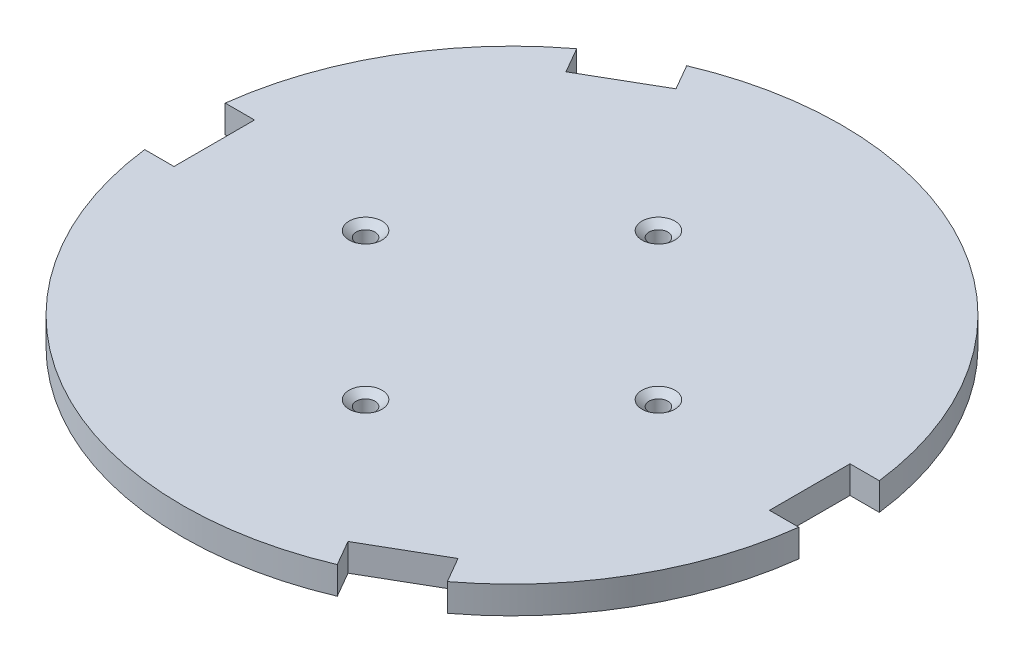
from build123d import *

# Parameters (mm, degrees)
SKETCH1_R                                         = 57.15
BOSS_EXTRUDE1_DEPTH                               = 4.7625
CUT_EXTRUDE2_REACH                                = 82.963
CUT_EXTRUDE3_REACH                                = 82.661
CSK_FOR_4_FLAT_HEAD_MACHINE_SCREW_100_D           = 3.2639
CSK_FOR_4_FLAT_HEAD_MACHINE_SCREW_100_CSINK_D     = 5.715
CSK_FOR_4_FLAT_HEAD_MACHINE_SCREW_100_CSINK_ANGLE = 100


with BuildPart() as part:
    # Sketch1 → Boss-Extrude1 (new body)
    with BuildSketch(Plane(origin=(0, 0, 0), x_dir=(1, 0, 0), z_dir=(0, 1, 0))):
        with Locations(Location((0, 0, 0), (0, 0, 90))):
            Circle(SKETCH1_R)
    extrude(amount=BOSS_EXTRUDE1_DEPTH)

    # Sketch2 → Cut-Extrude2 (cut, up to next)
    with BuildSketch(Plane(origin=(0, 4.7625, 0), x_dir=(1, 0, 0), z_dir=(0, 1, 0)), mode=Mode.PRIVATE) as cut_extrude2_sk1:
        with BuildLine():
            Line((51.641532728, 6.985), (51.641532728, -6.985))
            Line((51.641532728, -6.985), (56.721532728, -6.985))
            ThreePointArc((56.721532728, -6.985), (57.15, 0), (56.721532728, 6.985))
            Line((56.721532728, 6.985), (51.641532728, 6.985))
        make_face()
    cut_extrude2_tool1 = extrude(cut_extrude2_sk1.sketch, amount=-CUT_EXTRUDE2_REACH, mode=Mode.PRIVATE) & part.part
    # Sketch2 → Cut-Extrude2 (cut, up to next)
    with BuildSketch(Plane(origin=(0, 4.7625, 0), x_dir=(1, 0, 0), z_dir=(0, 1, 0)), mode=Mode.PRIVATE) as cut_extrude2_sk2:
        with BuildLine():
            Line((-51.641532728, 6.985), (-56.721532728, 6.985))
            ThreePointArc((-56.721532728, 6.985), (-57.15, 0), (-56.721532728, -6.985))
            Line((-56.721532728, -6.985), (-51.641532728, -6.985))
            Line((-51.641532728, -6.985), (-51.641532728, 6.985))
        make_face()
    cut_extrude2_tool2 = extrude(cut_extrude2_sk2.sketch, amount=-CUT_EXTRUDE2_REACH, mode=Mode.PRIVATE) & part.part
    add(cut_extrude2_tool1.solids().sort_by_distance((54.325982, 4.7625, 0))[0], mode=Mode.SUBTRACT)
    add(cut_extrude2_tool2.solids().sort_by_distance((-54.325982, 4.7625, 0))[0], mode=Mode.SUBTRACT)

    # Sketch3 → Cut-Extrude3 (cut, up to next)
    with BuildSketch(Plane(origin=(0, 4.7625, 0), x_dir=(1, 0, 0), z_dir=(0, 1, 0)), mode=Mode.PRIVATE) as cut_extrude3_sk1:
        with BuildLine():
            Line((19.771578919, -48.215379233), (31.869953809, -41.230379233))
            Line((31.869953809, -41.230379233), (34.409953809, -45.629788284))
            ThreePointArc((34.409953809, -45.629788284), (28.575, -49.493351826), (22.311578919, -52.614788284))
            Line((22.311578919, -52.614788284), (19.771578919, -48.215379233))
        make_face()
    cut_extrude3_tool1 = extrude(cut_extrude3_sk1.sketch, amount=-CUT_EXTRUDE3_REACH, mode=Mode.PRIVATE) & part.part
    # Sketch3 → Cut-Extrude3 (cut, up to next)
    with BuildSketch(Plane(origin=(0, 4.7625, 0), x_dir=(1, 0, 0), z_dir=(0, 1, 0)), mode=Mode.PRIVATE) as cut_extrude3_sk2:
        with BuildLine():
            Line((-31.869953809, 41.230379233), (-34.409953809, 45.629788284))
            ThreePointArc((-34.409953809, 45.629788284), (-28.575, 49.493351826), (-22.311578919, 52.614788284))
            Line((-22.311578919, 52.614788284), (-19.771578919, 48.215379233))
            Line((-19.771578919, 48.215379233), (-31.869953809, 41.230379233))
        make_face()
    cut_extrude3_tool2 = extrude(cut_extrude3_sk2.sketch, amount=-CUT_EXTRUDE3_REACH, mode=Mode.PRIVATE) & part.part
    add(cut_extrude3_tool1.solids().sort_by_distance((27.162991, 4.7625, 47.04768))[0], mode=Mode.SUBTRACT)
    add(cut_extrude3_tool2.solids().sort_by_distance((-27.162991, 4.7625, -47.04768))[0], mode=Mode.SUBTRACT)

    # CSK for #4 Flat Head Machine Screw (100)1 (through all)
    with Locations(Plane(origin=(0, 4.7625, 0), x_dir=(1, 0, 0), z_dir=(0, 1, 0))):
        with Locations((25.4, 0), (0, -25.4), (0, 25.4), (-25.4, 0)):
            CounterSinkHole(CSK_FOR_4_FLAT_HEAD_MACHINE_SCREW_100_D / 2, CSK_FOR_4_FLAT_HEAD_MACHINE_SCREW_100_CSINK_D / 2, counter_sink_angle=CSK_FOR_4_FLAT_HEAD_MACHINE_SCREW_100_CSINK_ANGLE)


solid = part.part
